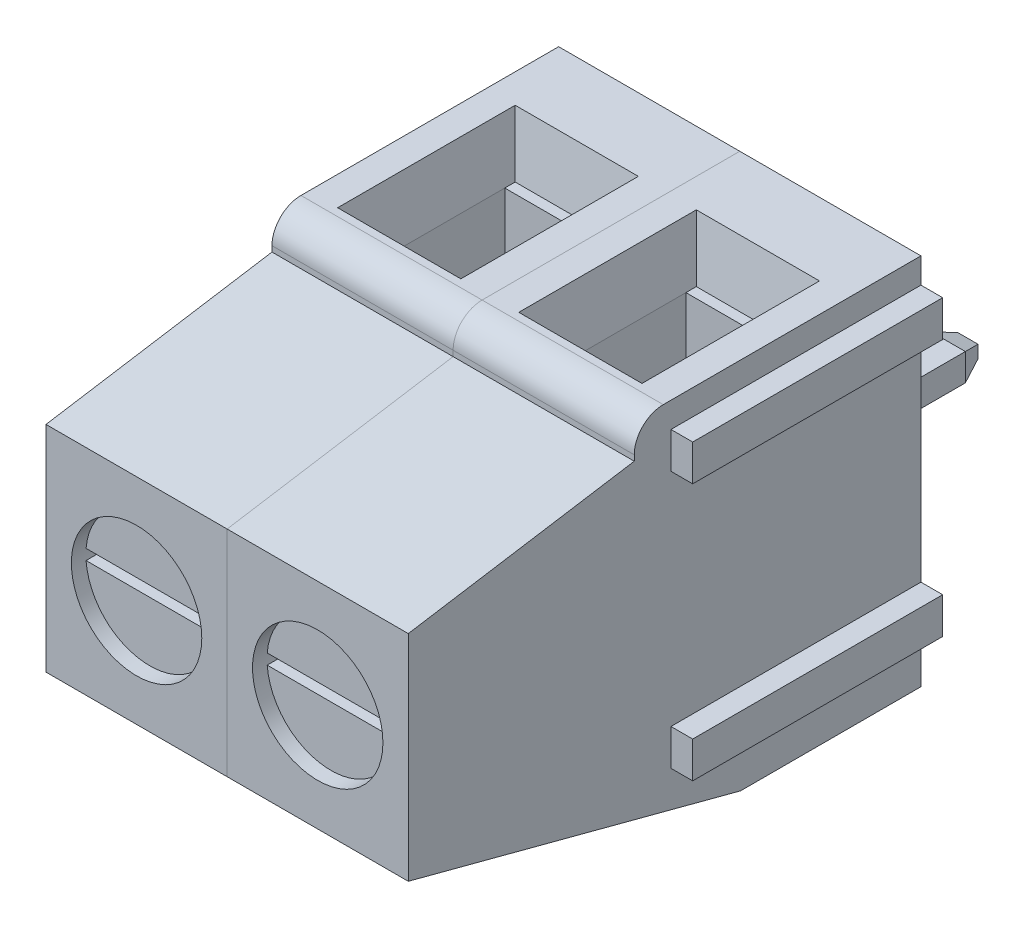
from build123d import *

# Parameters (mm, degrees)
SKETCH_3_W             = 5
SKETCH_3_H             = 10.3
EXTRUDE_2_DEPTH        = 14.15
CUT_EXTRUDE_3_DEPTH    = 6.9
CUT_EXTRUDE_4_DEPTH    = 16.915794042
SKETCH_7_W             = 3.4
SKETCH_7_H             = 4.9
CUT_EXTRUDE_5_DEPTH    = 1.6
CUT_EXTRUDE_5_DRAFT    = -10
EXTRUDE_3_DEPTH        = 4.6
CUT_EXTRUDE_START      = 5
SKETCH_11_W            = 2
SKETCH_11_H            = 1.3
CUT_EXTRUDE_6_DEPTH    = 11.315433392
EXTRUDE_6_DEPTH        = 0.5
EXTRUDE_7_DEPTH        = 0.5
SKETCH_15_R            = 1.8
CUT_EXTRUDE_7_DEPTH    = 1.5
SKETCH_16_R            = 1.75
EXTRUDE_8_DEPTH        = 0.5
EXTRUDE_9_DEPTH        = 0.6
SKETCH_18_W            = 0.6
SKETCH_18_H            = 1
EXTRUDE_10_DEPTH       = 6.9
SKETCH_19_W            = 0.6
SKETCH_19_H            = 1
CUT_EXTRUDE_8_DEPTH    = 6.9
EXTRUDE_11_DEPTH       = 3
SKETCH_21_W            = 0.283883543
SKETCH_21_H            = 3.570036942
CUT_EXTRUDE_9_DEPTH    = 1.9
SKETCH_22_W            = 3
SKETCH_22_H            = 3.810788474
EXTRUDE_12_DEPTH       = 5.9
SKETCH_23_W            = 2.84985982
SKETCH_23_H            = 2.875915074
CUT_EXTRUDE_10_DEPTH   = 5.9
EXTRUDE_13_DEPTH       = 0.816289
EXTRUDE_13_DEPTH_BACK  = 3.8
SKETCH_24_W            = 0.95
SKETCH_24_H            = 0.75
CHAMFER_1_SIZE         = 0.2
CHAMFER_1_SIZE2        = 0.549495484
PATTERN_LINEAR_1_COUNT = 2
PATTERN_LINEAR_1_PITCH = 5


with BuildPart() as part:
    # Эскиз3 → Бобышка-Вытянуть2 (new body)
    with BuildSketch(Plane.XY):
        with Locations((0, 0.15)):
            Rectangle(SKETCH_3_W, SKETCH_3_H)
    extrude(amount=EXTRUDE_2_DEPTH)

    # Эскиз5 → Вырез-Вытянуть3 (cut)
    with BuildSketch(Plane(origin=(0, 0, 0), x_dir=(-1, 0, 0), z_dir=(0, 0, -1))):
        Polygon((-1.5, 3.74), (1.5, 3.74), (1.5, -3.74), (1.5, -4.14), (-1.5, -4.14), (-1.5, -3.74), align=None)
    extrude(amount=-CUT_EXTRUDE_3_DEPTH, mode=Mode.SUBTRACT)

    # Эскиз6 → Вырез-Вытянуть4 (cut, through all)
    with BuildSketch(Plane(origin=(2.5, 0, 0), x_dir=(0, 0, -1), z_dir=(1, 0, 0))):
        Polygon((-4.978160995, -5), (-14.15, -2.576410242), (-14.15, -5), align=None)
        with BuildLine():
            Line((-7.112921872, 5.3), (-14.15, 5.3))
            Line((-14.15, 5.3), (-14.15, 3.345524226))
            Line((-14.15, 3.345524226), (-7.912921872, 4.347375018))
            Line((-7.912921872, 4.347375018), (-7.912921872, 4.5))
            ThreePointArc((-7.912921872, 4.5), (-7.678607297, 5.065685425), (-7.112921872, 5.3))
        make_face()
    extrude(amount=-CUT_EXTRUDE_4_DEPTH, mode=Mode.SUBTRACT)


with BuildPart() as cut_extrude_5_tool:
    # Эскиз7 → Вырез-Вытянуть5 (with draft: the straight prism first)
    with BuildSketch(Plane(origin=(0, 5.3, 0), x_dir=(1, 0, 0), z_dir=(0, 1, 0))):
        with Locations((0, -4.45)):
            Rectangle(SKETCH_7_W, SKETCH_7_H)
    extrude(amount=-CUT_EXTRUDE_5_DEPTH)
    # Вырез-Вытянуть5: the draft: its side faces are tilted about the plane it starts from
    cut_extrude_5_sides = [cut_extrude_5_tool.faces().sort_by_distance(p)[0] for p in [
        (1.7, 4.5, 4.45),
        (0, 4.5, 2),
        (-1.7, 4.5, 4.45),
        (0, 4.5, 6.9),
    ]]
    draft(cut_extrude_5_sides, Plane(origin=(0, 5.3, 0), x_dir=(1, 0, 0), z_dir=(0, 1, 0)), CUT_EXTRUDE_5_DRAFT)


with BuildPart() as part_1:
    add(part.part)

    # Вырез-Вытянуть5: cut by cut_extrude_5_tool
    add(cut_extrude_5_tool.part, mode=Mode.SUBTRACT)

    # Эскиз10 → Бобышка-Вытянуть3 (add)
    with BuildSketch(Plane.ZY.offset(2.5)):
        Polygon((6.9, 5.3), (5.55744059, 3.7), (6.9, 3.7), align=None)
    extrude(amount=-EXTRUDE_3_DEPTH)

    # Эскиз11 → Вырез-Вытянуть6 (cut, through all)
    with BuildSketch(Plane.XY.offset(CUT_EXTRUDE_START)):
        with Locations((0, -4.35)):
            Rectangle(SKETCH_11_W, SKETCH_11_H)
    extrude(amount=CUT_EXTRUDE_6_DEPTH, mode=Mode.SUBTRACT)

    # Эскиз13 → Бобышка-Вытянуть6 (add)
    with BuildSketch(Plane(origin=(-1, 0, 0), x_dir=(0, 0, -1), z_dir=(1, 0, 0))):
        Polygon((-6.9, -3.7), (-6.989984762, -4.206397805), (-5, -4.34750887), (-5, -4.14), align=None)
    extrude(amount=-EXTRUDE_6_DEPTH)

    # Эскиз14 → Бобышка-Вытянуть7 (add)
    with BuildSketch(Plane.ZY.offset(-1)):
        Polygon((6.9, -3.7), (5, -4.14), (5, -4.474972991), (7.040681083, -4.307486495), align=None)
    extrude(amount=-EXTRUDE_7_DEPTH)

    # Эскиз15 → Вырез-Вытянуть7 (cut)
    with BuildSketch(Plane.XY.offset(14.15)):
        with Locations((0, 0.384556992)):
            Circle(SKETCH_15_R)
    extrude(amount=-CUT_EXTRUDE_7_DEPTH, mode=Mode.SUBTRACT)



with BuildPart() as body_2:
    # Эскиз16 → Бобышка-Вытянуть8 (new body)
    with BuildSketch(Plane.XY.offset(12.65)):
        with Locations((0, 0.384556992)):
            Circle(SKETCH_16_R)
    extrude(amount=EXTRUDE_8_DEPTH)


with BuildPart() as part_2:
    add(part_1.part)

    add(body_2.part)  # Бобышка-Вытянуть9 merges body 2
    # Эскиз17 → Бобышка-Вытянуть9 (add)
    with BuildSketch(Plane.XY.offset(13.15)):
        with BuildLine():
            Line((1.744500962, 0.535610397), (-1.8107336, 0.535610397))
            ThreePointArc((-1.8107336, 0.535610397), (-0.033116319, 2.173610004), (1.744500962, 0.535610397))
        make_face()
        with BuildLine():
            Line((1.744500962, 0.244474499), (-1.8107336, 0.244474499))
            ThreePointArc((-1.8107336, 0.244474499), (-0.033116319, -1.393525108), (1.744500962, 0.244474499))
        make_face()
    extrude(amount=EXTRUDE_9_DEPTH)

    # Эскиз18 → Бобышка-Вытянуть10 (add)
    with BuildSketch(Plane(origin=(0, 0, 0), x_dir=(-1, 0, 0), z_dir=(0, 0, -1))):
        with Locations((-2.8, 4.1)):
            Rectangle(SKETCH_18_W, SKETCH_18_H)
        with Locations((-2.8, -3)):
            Rectangle(SKETCH_18_W, SKETCH_18_H)
    extrude(amount=-EXTRUDE_10_DEPTH)

    # Эскиз19 → Вырез-Вытянуть8 (cut)
    with BuildSketch(Plane(origin=(0, 0, 0), x_dir=(-1, 0, 0), z_dir=(0, 0, -1))):
        with Locations((2.2, 4.1)):
            Rectangle(SKETCH_19_W, SKETCH_19_H)
        with Locations((2.2, -3)):
            Rectangle(SKETCH_19_W, SKETCH_19_H)
    extrude(amount=-CUT_EXTRUDE_8_DEPTH, mode=Mode.SUBTRACT)


with BuildPart() as body_2_2:
    # Эскиз20 → Бобышка-Вытянуть11 (new body)
    with BuildSketch(Plane.ZY.offset(-1.5)):
        Polygon((6.9, -3.7), (0.816288508, -3.7), (0.816288508, 0.478218555), (1.191891913, 0.478218555), (1.191891913, -3.382298583), (7.025119198, -3.382298583), align=None)
    extrude(amount=EXTRUDE_11_DEPTH)

    # Эскиз21 → Вырез-Вытянуть9 (cut)
    with BuildSketch(Plane(origin=(0, 0, 0.816288508), x_dir=(-1, 0, 0), z_dir=(0, 0, -1))):
        with Locations((1.358058229, -1.306799916)):
            Rectangle(SKETCH_21_W, SKETCH_21_H)
        with Locations((-1.358058229, -1.306799916)):
            Rectangle(SKETCH_21_W, SKETCH_21_H)
    extrude(amount=-CUT_EXTRUDE_9_DEPTH, mode=Mode.SUBTRACT)


with BuildPart() as body_3:
    # Эскиз22 → Бобышка-Вытянуть12 (new body)
    with BuildSketch(Plane(origin=(0, 3.74, 0), x_dir=(-1, 0, 0), z_dir=(0, -1, 0))):
        with Locations((0, -3.945734069)):
            Rectangle(SKETCH_22_W, SKETCH_22_H)
    extrude(amount=EXTRUDE_12_DEPTH)

    # Эскиз23 → Вырез-Вытянуть10 (cut)
    with BuildSketch(Plane(origin=(0, 3.74, 0), x_dir=(1, 0, 0), z_dir=(0, 1, 0))):
        with Locations((0, -3.999958183)):
            Rectangle(SKETCH_23_W, SKETCH_23_H)
    extrude(amount=-CUT_EXTRUDE_10_DEPTH, mode=Mode.SUBTRACT)


with BuildPart() as body_4:
    # Эскиз24 → Бобышка-Вытянуть13 (new, two sides: drawn at the far end of the back side and taken through both)
    with BuildSketch(Plane.XY.offset(-EXTRUDE_13_DEPTH_BACK)):
        Rectangle(SKETCH_24_W, SKETCH_24_H)
    extrude(amount=EXTRUDE_13_DEPTH + EXTRUDE_13_DEPTH_BACK)

    # Фаска1
    chamfer_1_edges = [body_4.edges().sort_by_distance(p)[0] for p in [
        (0.475, 0, -3.8),
        (0, 0.375, -3.8),
        (-0.475, 0, -3.8),
        (0, -0.375, -3.8),
    ]]
    chamfer_1_side = [body_4.faces().sort_by_distance(p)[0] for p in [
        (0, 0, -3.8),
    ]]
    chamfer(chamfer_1_edges, length=CHAMFER_1_SIZE, length2=CHAMFER_1_SIZE2, reference=chamfer_1_side[0])


with BuildPart() as pattern_linear_1_1:
    # Линейный массив1: pattern copy
    add(part_2.part.moved(Location(Vector(-1, 0, 0) * (1 * PATTERN_LINEAR_1_PITCH))))


with BuildPart() as pattern_linear_1_2:
    # Линейный массив1: pattern copy
    add(body_4.part.moved(Location(Vector(-1, 0, 0) * (1 * PATTERN_LINEAR_1_PITCH))))


with BuildPart() as pattern_linear_1_3:
    # Линейный массив1: pattern copy
    add(body_3.part.moved(Location(Vector(-1, 0, 0) * (1 * PATTERN_LINEAR_1_PITCH))))


with BuildPart() as pattern_linear_1_4:
    # Линейный массив1: pattern copy
    add(body_2_2.part.moved(Location(Vector(-1, 0, 0) * (1 * PATTERN_LINEAR_1_PITCH))))


solid = Compound([part_2.part, body_2_2.part, body_3.part, body_4.part, pattern_linear_1_1.part, pattern_linear_1_2.part, pattern_linear_1_3.part, pattern_linear_1_4.part])
